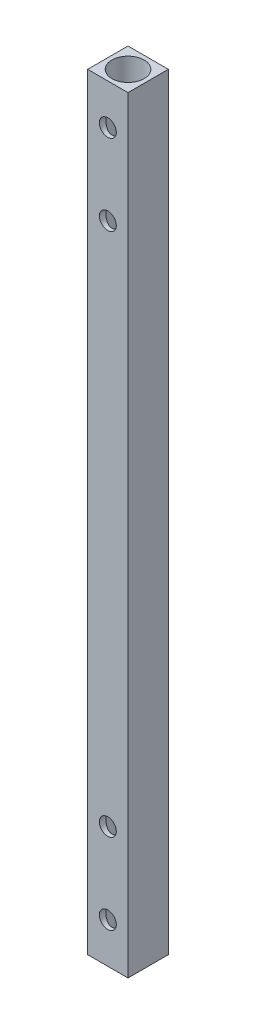
from build123d import *

# Parameters (mm, degrees)
SKETCH_1_W          = 10
SKETCH_1_H          = 10
EXTRUDE_1_DEPTH     = 190
SKETCH_2_R          = 2.1
CUT_EXTRUDE_1_DEPTH = 200
SKETCH_3_R          = 4
CUT_EXTRUDE_2_DEPTH = 191.131533418


with BuildPart() as part:
    # 草图1 → 凸台-拉伸1 (new body)
    with BuildSketch(Plane(origin=(0, 0, 0), x_dir=(1, 0, 0), z_dir=(0, 1, 0))):
        Rectangle(SKETCH_1_W, SKETCH_1_H)
    extrude(amount=EXTRUDE_1_DEPTH)

    # 草图2 → 切除-拉伸1 (cut)
    with BuildSketch(Plane.XY.offset(5)):
        with Locations((0, 10)):
            Circle(SKETCH_2_R)
        with Locations((0, 30)):
            Circle(SKETCH_2_R)
        with Locations((0, 180)):
            Circle(SKETCH_2_R)
        with Locations((0, 160)):
            Circle(SKETCH_2_R)
    extrude(amount=-CUT_EXTRUDE_1_DEPTH, mode=Mode.SUBTRACT)

    # 草图3 → 切除-拉伸2 (cut, through all)
    with BuildSketch(Plane.XZ):
        with Locations(Location((0, 0, 0), (0, 0, 270))):
            Circle(SKETCH_3_R)
    extrude(amount=-CUT_EXTRUDE_2_DEPTH, mode=Mode.SUBTRACT)


solid = part.part
